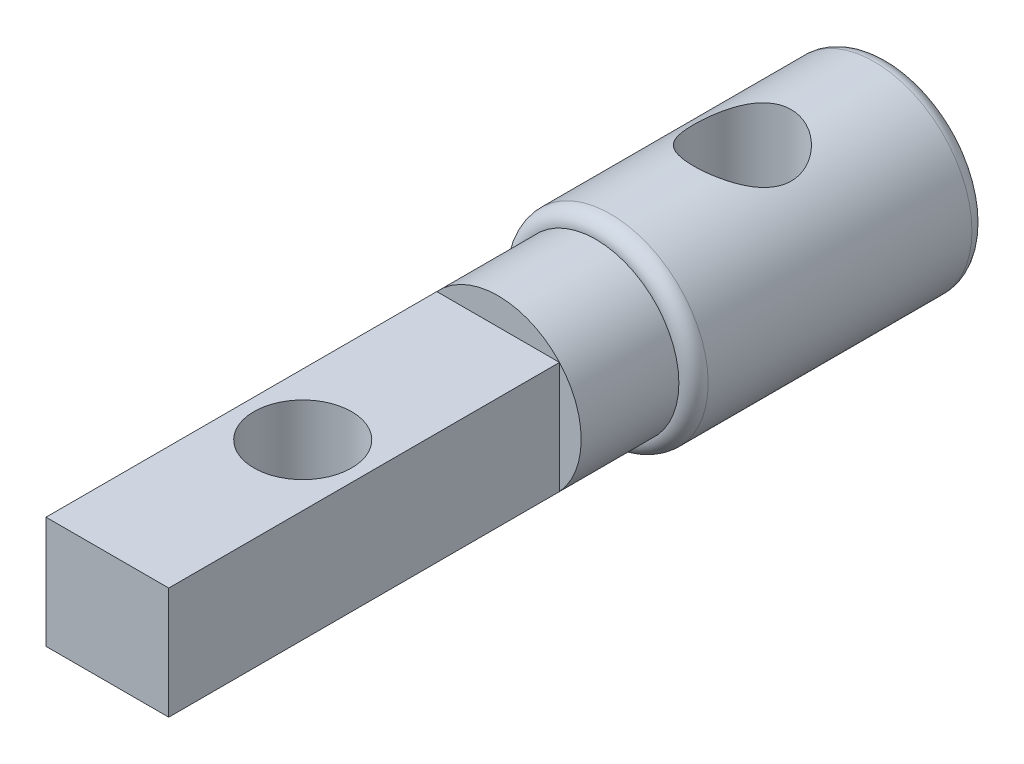
from build123d import *

# Parameters (mm, degrees)
SKETCH1_R               = 20
BOSS_EXTRUDE1_DEPTH     = 60
CUT_EXTRUDE1_DEPTH      = 67.332495807
CUT_EXTRUDE1_DEPTH_BACK = 67.332495807
SKETCH2_R               = 10
FILLET1_R               = 3
SKETCH22_R              = 17
BOSS_EXTRUDE4_DEPTH     = 100
CUT_EXTRUDE4_DEPTH      = 100
CUT_EXTRUDE4_DEPTH_BACK = 100
SKETCH19_R              = 10
CUT_EXTRUDE5_START      = -80
CUT_EXTRUDE5_DEPTH      = 80


with BuildPart() as part:
    # Sketch1 → Boss-Extrude1 (new body)
    with BuildSketch(Plane.XY):
        Circle(SKETCH1_R)
    extrude(amount=BOSS_EXTRUDE1_DEPTH)

    # Sketch2 → Cut-Extrude1 (cut, two sides: drawn at the far end of the back side and taken through both)
    with BuildSketch(Plane(origin=(0, 0, 0), x_dir=(1, 0, 0), z_dir=(0, 1, 0)).offset(-CUT_EXTRUDE1_DEPTH_BACK)):
        with Locations((0, -30)):
            Circle(SKETCH2_R)
    extrude(amount=CUT_EXTRUDE1_DEPTH + CUT_EXTRUDE1_DEPTH_BACK, mode=Mode.SUBTRACT)

    # Fillet1
    fillet1_edges = [part.edges().sort_by_distance(p)[0] for p in [
        (-20, 0, 0),
        (-20, 0, 60),
    ]]
    fillet(fillet1_edges, radius=FILLET1_R)

    # Sketch22 → Boss-Extrude4 (add)
    with BuildSketch(Plane.XY.offset(60)):
        Circle(SKETCH22_R)
    extrude(amount=BOSS_EXTRUDE4_DEPTH)

    # Sketch19 → Cut-Extrude4 (cut, two sides: drawn at the far end of the back side and taken through both)
    with BuildSketch(Plane(origin=(0, 0, 0), x_dir=(1, 0, 0), z_dir=(0, 1, 0)).offset(-CUT_EXTRUDE4_DEPTH_BACK)):
        with Locations((0, -120)):
            Circle(SKETCH19_R)
    extrude(amount=CUT_EXTRUDE4_DEPTH + CUT_EXTRUDE4_DEPTH_BACK, mode=Mode.SUBTRACT)

    # Sketch23 → Cut-Extrude5 (cut)
    with BuildSketch(Plane.XY.offset(160).offset(CUT_EXTRUDE5_START)):
        with BuildLine():
            ThreePointArc((12.56265543, 11.453370183), (0, 17), (-12.56265543, 11.453370183))
            Line((-12.56265543, 11.453370183), (12.56265543, 11.453370183))
        make_face()
        with BuildLine():
            Line((-12.56265543, -11.453370183), (-12.56265543, 11.453370183))
            ThreePointArc((-12.56265543, 11.453370183), (-17, 0), (-12.56265543, -11.453370183))
        make_face()
        with BuildLine():
            ThreePointArc((12.56265543, -11.453370183), (17, 0), (12.56265543, 11.453370183))
            Line((12.56265543, 11.453370183), (12.56265543, -11.453370183))
        make_face()
        with BuildLine():
            Line((12.56265543, -11.453370183), (-12.56265543, -11.453370183))
            ThreePointArc((-12.56265543, -11.453370183), (0, -17), (12.56265543, -11.453370183))
        make_face()
    extrude(amount=CUT_EXTRUDE5_DEPTH, mode=Mode.SUBTRACT)


solid = part.part
